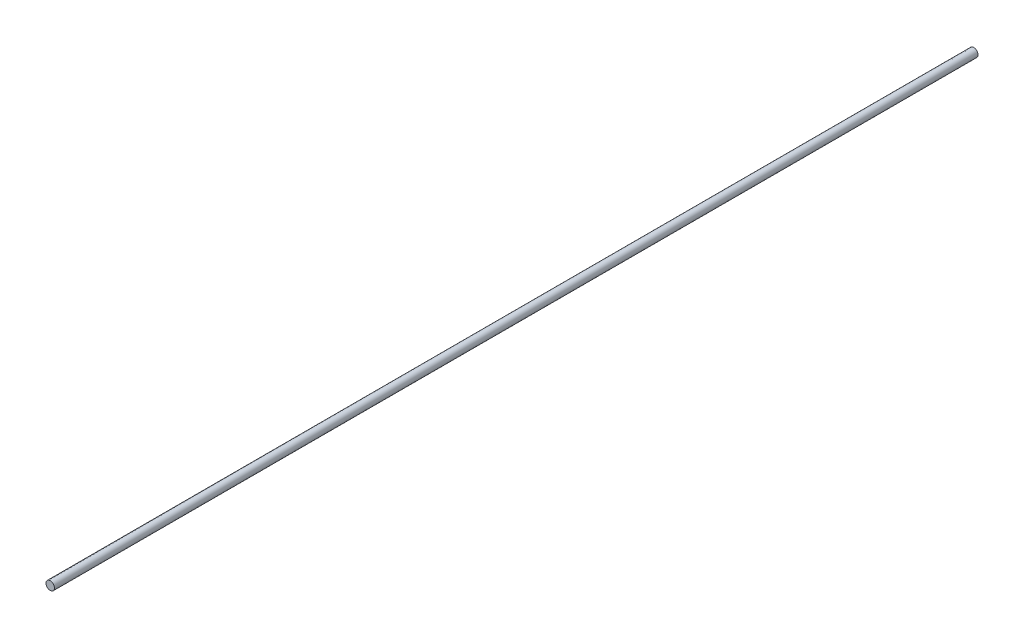
from build123d import *

# Parameters (mm, degrees)
SKETCH1_R                   = 1.5
THREAD_MAJOR_ENVELOPE_DEPTH = 327


with BuildPart() as part:
    # Sketch1 → Thread_Major_Envelope (new body)
    with BuildSketch(Plane.XY):
        Circle(SKETCH1_R)
    extrude(amount=THREAD_MAJOR_ENVELOPE_DEPTH)


solid = part.part
